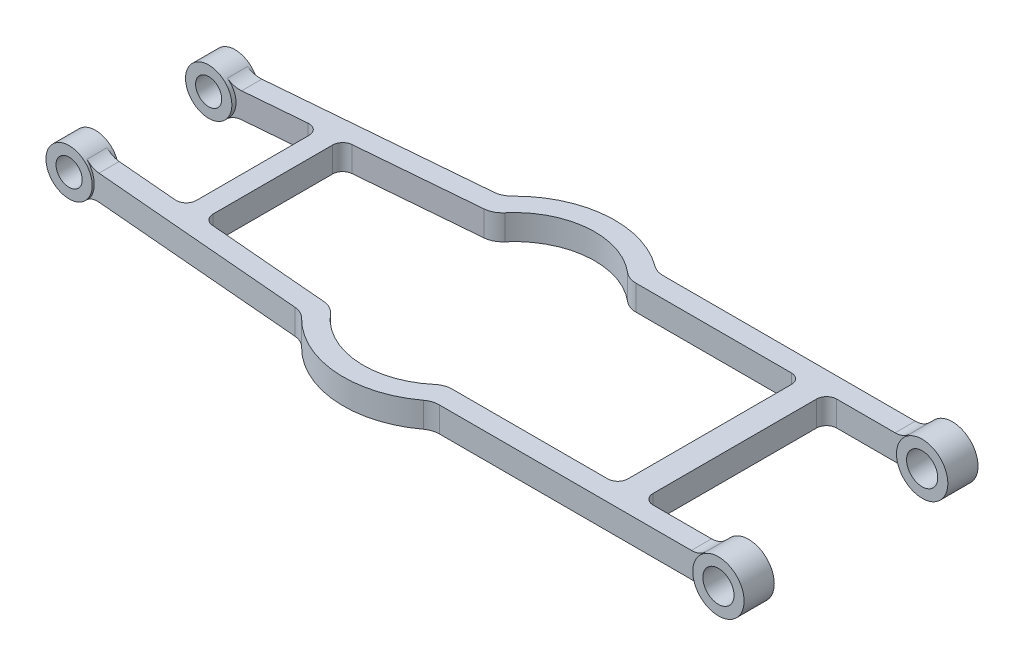
from build123d import *

# Parameters (mm, degrees)
SKETCH_1_R          = 4.6
SKETCH_1_R_2        = 2.6
EXTRUDE_1_DEPTH     = 16.5
SKETCH_2_R          = 5.1
SKETCH_2_R_2        = 3.1
EXTRUDE_2_DEPTH     = 23.25
EXTRUDE_3_DEPTH     = 2.5
SKETCH_4_W          = 4
SKETCH_4_H          = 5
EXTRUDE_4_DEPTH     = 14
SKETCH_5_W          = 5
SKETCH_5_H          = 5
EXTRUDE_5_DEPTH     = 21
SKETCH_7_W          = 23.250119988
SKETCH_7_H          = 22.5
SKETCH_7_W_2        = 28.223053091
SKETCH_7_H_2        = 34.5
CUT_EXTRUDE_1_DEPTH = 21
FILLET_1_R          = 2
FILLET_2_R          = 4
FILLET_3_R          = 4


with BuildPart() as part:
    # 草图1 → 凸台-拉伸1 (new, symmetric)
    with BuildSketch(Plane.XY):
        Circle(SKETCH_1_R)
        Circle(SKETCH_1_R_2, mode=Mode.SUBTRACT)
    extrude(amount=EXTRUDE_1_DEPTH, both=True)



with BuildPart() as body_2:
    # 草图2 → 凸台-拉伸2 (new, symmetric)
    with BuildSketch(Plane.XY):
        with Locations(Location((135.83, 0, 0), (0, 0, 180))):
            Circle(SKETCH_2_R)
        with Locations(Location((135.83, 0, 0), (0, 0, 180))):
            Circle(SKETCH_2_R_2, mode=Mode.SUBTRACT)
    extrude(amount=EXTRUDE_2_DEPTH, both=True)


with BuildPart() as part_1:
    add(part.part)

    add(body_2.part)  # 凸台-拉伸3 merges body 2
    # 草图3 → 凸台-拉伸3 (add, symmetric)
    with BuildSketch(Plane(origin=(0, 0, 0), x_dir=(1, 0, 0), z_dir=(0, 1, 0))):
        with BuildLine():
            Line((132.183492931, 22.25), (77.939764295, 22.25))
            ThreePointArc((77.939764295, 22.25), (63.354138409, 26.932163446), (49.734070133, 19.920966887))
            Line((49.734070133, 19.920966887), (3.331299064, 15.992872298))
            Line((3.331299064, 15.992872298), (3.668700936, 12.007127702))
            Line((3.668700936, 12.007127702), (47.661946379, 15.731250754))
            Line((47.661946379, 15.731250754), (51.828770684, 16.083981413))
            ThreePointArc((51.828770684, 16.083981413), (63.593703521, 22.938077996), (76.377060253, 18.25))
            Line((76.377060253, 18.25), (81.535945694, 18.25))
            Line((81.535945694, 18.25), (132.183492931, 18.25))
            Line((132.183492931, 18.25), (132.183492931, 22.25))
        make_face()
        with BuildLine():
            Line((132.183492931, -18.25), (81.535945694, -18.25))
            Line((81.535945694, -18.25), (76.377060253, -18.25))
            ThreePointArc((76.377060253, -18.25), (63.593703521, -22.938077996), (51.828770684, -16.083981413))
            Line((51.828770684, -16.083981413), (47.661946379, -15.731250754))
            Line((47.661946379, -15.731250754), (3.668700936, -12.007127702))
            Line((3.668700936, -12.007127702), (3.331299064, -15.992872298))
            Line((3.331299064, -15.992872298), (49.734070133, -19.920966887))
            ThreePointArc((49.734070133, -19.920966887), (63.354138409, -26.932163446), (77.939764295, -22.25))
            Line((77.939764295, -22.25), (132.183492931, -22.25))
            Line((132.183492931, -22.25), (132.183492931, -18.25))
        make_face()
    extrude(amount=EXTRUDE_3_DEPTH, both=True)

    # 草图4 → 凸台-拉伸4 (add, symmetric)
    with BuildSketch(Plane.XY):
        with Locations((22, 0)):
            Rectangle(SKETCH_4_W, SKETCH_4_H)
    extrude(amount=EXTRUDE_4_DEPTH, both=True)

    # 草图5 → 凸台-拉伸5 (add, symmetric)
    with BuildSketch(Plane.XY):
        with Locations((113.33, 0)):
            Rectangle(SKETCH_5_W, SKETCH_5_H)
    extrude(amount=EXTRUDE_5_DEPTH, both=True)

    # 草图7 → 切除-拉伸1 (cut, symmetric)
    with BuildSketch(Plane(origin=(0, 0, 0), x_dir=(1, 0, 0), z_dir=(0, 1, 0))):
        Rectangle(SKETCH_7_W, SKETCH_7_H)
        with Locations((131.320513742, 0)):
            Rectangle(SKETCH_7_W_2, SKETCH_7_H_2)
    extrude(amount=CUT_EXTRUDE_1_DEPTH, both=True, mode=Mode.SUBTRACT)

    # 圆角1
    fillet_1_edges = [part_1.edges().sort_by_distance(p)[0] for p in [
        (115.83, 0, 18.25),
        (110.83, 0, 18.25),
        (110.83, 0, -18.25),
        (115.83, 0, -18.25),
        (24, 0, 13.728215991),
        (20, 0, 13.38960737),
        (20, 0, -13.38960737),
        (24, 0, -13.728215991),
    ]]
    fillet(fillet_1_edges, radius=FILLET_1_R)

    # 圆角2
    fillet_2_edges = [part_1.edges().sort_by_distance(p)[0] for p in [
        (51.828770684, 0, -16.083981413),
        (76.377060253, 0, -18.25),
        (77.939764295, 0, -22.25),
        (49.734070133, 0, -19.920966887),
        (76.377060253, 0, 18.25),
        (51.828770684, 0, 16.083981413),
        (49.734070133, 0, 19.920966887),
        (77.939764295, 0, 22.25),
    ]]
    fillet(fillet_2_edges, radius=FILLET_2_R)

    # 圆角3
    fillet_3_edges = [part_1.edges().sort_by_distance(p)[0] for p in [
        (131.384777846, -2.5, -20.25),
        (131.384777846, 2.5, -20.25),
        (131.384777846, -2.5, 20.25),
        (131.384777846, 2.5, 20.25),
        (3.861346915, 2.5, 14.030588795),
        (3.861346915, -2.5, 14.030588795),
        (3.861346915, -2.5, -14.030588795),
        (3.861346915, 2.5, -14.030588795),
    ]]
    fillet(fillet_3_edges, radius=FILLET_3_R)


solid = part_1.part
